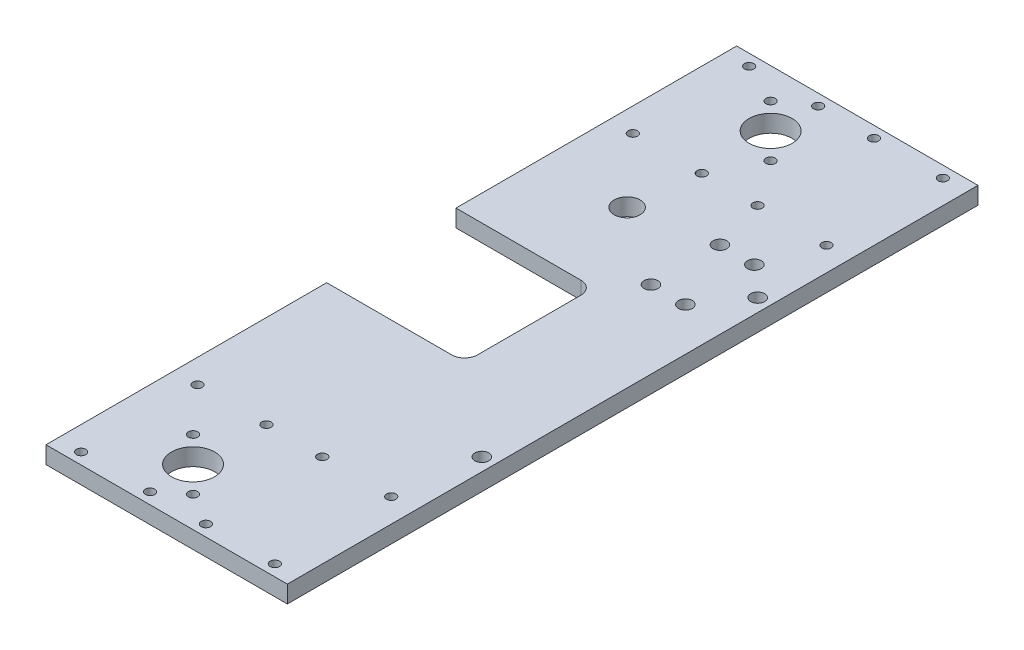
from build123d import *

# Parameters (mm, degrees)
SKETCH1_R              = 4.7625
SKETCH1_R_2            = 7.9375
BOSS_EXTRUDE1_DEPTH    = 6.35
F_8_32_TAPPED_HOLE1_D  = 3.4544
F_10_CLEARANCE_HOLE1_D = 5.1054
F_8_32_TAPPED_HOLE2_D  = 3.4544


with BuildPart() as part:
    # Sketch1 → Boss-Extrude1 (new body)
    with BuildSketch(Plane(origin=(0, 0, 0), x_dir=(1, 0, 0), z_dir=(0, 1, 0))):
        with BuildLine():
            Line((-22.186740071, -110.035971993), (-22.186740071, -213.413971993))
            Line((-22.186740071, -213.413971993), (66.713259929, -213.413971993))
            Line((66.713259929, -213.413971993), (66.713259929, 40.967028007))
            Line((66.713259929, 40.967028007), (-22.186740071, 40.967028007))
            Line((-22.186740071, 40.967028007), (-22.186740071, -62.410971993))
            Line((-22.186740071, -62.410971993), (23.850759929, -62.410971993))
            ThreePointArc((23.850759929, -62.410971993), (27.218355974, -63.805875948), (28.613259929, -67.173471993))
            Line((28.613259929, -67.173471993), (28.613259929, -105.273471993))
            ThreePointArc((28.613259929, -105.273471993), (27.218355974, -108.641068039), (23.850759929, -110.035971993))
            Line((23.850759929, -110.035971993), (-22.186740071, -110.035971993))
        make_face()
        with Locations(Location((9.106059929, -30.660971993, 0), (0, 0, 270))):
            Circle(SKETCH1_R, mode=Mode.SUBTRACT)
        with Locations(Location((11.150759929, 20.139028007, 0), (0, 0, 270))):
            Circle(SKETCH1_R_2, mode=Mode.SUBTRACT)
        with Locations(Location((11.150759929, -192.585971993, 0), (0, 0, 270))):
            Circle(SKETCH1_R_2, mode=Mode.SUBTRACT)
    extrude(amount=BOSS_EXTRUDE1_DEPTH)

    # #8-32 Tapped Hole1 (through all)
    with Locations(Plane(origin=(0, 6.35, 0), x_dir=(1, 0, 0), z_dir=(0, 1, 0))):
        with Locations((-13.411040071, -166.392221993), (11.988959929, -166.392221993), (11.988959929, -209.254721993), (-13.411040071, -209.254721993), (57.937559929, -209.254721993), (32.537559929, -209.254721993), (32.537559929, -166.392221993), (57.937559929, -166.392221993), (32.537559929, -6.054721993), (57.937559929, -6.054721993), (57.937559929, 36.807778007), (32.537559929, 36.807778007), (-13.411040071, 36.807778007), (11.988959929, 36.807778007), (11.988959929, -6.054721993), (-13.411040071, -6.054721993)):
            Hole(F_8_32_TAPPED_HOLE1_D / 2)

    # #10 Clearance Hole1 (through all)
    with Locations(Plane(origin=(0, 6.35, 0), x_dir=(1, 0, 0), z_dir=(0, 1, 0))):
        with Locations((61.950759929, -137.023471993), (38.138259929, -25.517471993), (61.950759929, -35.423471993), (50.838259929, -25.517471993), (50.838259929, -50.917471993), (38.138259929, -50.917471993)):
            Hole(F_10_CLEARANCE_HOLE1_D / 2)

    # #8-32 Tapped Hole2 (through all)
    with Locations(Plane(origin=(0, 6.35, 0), x_dir=(1, 0, 0), z_dir=(0, 1, 0))):
        with Locations((1.625759929, 29.664028007), (20.675759929, 10.614028007), (1.625759929, -183.060971993), (20.675759929, -202.110971993)):
            Hole(F_8_32_TAPPED_HOLE2_D / 2)


solid = part.part
